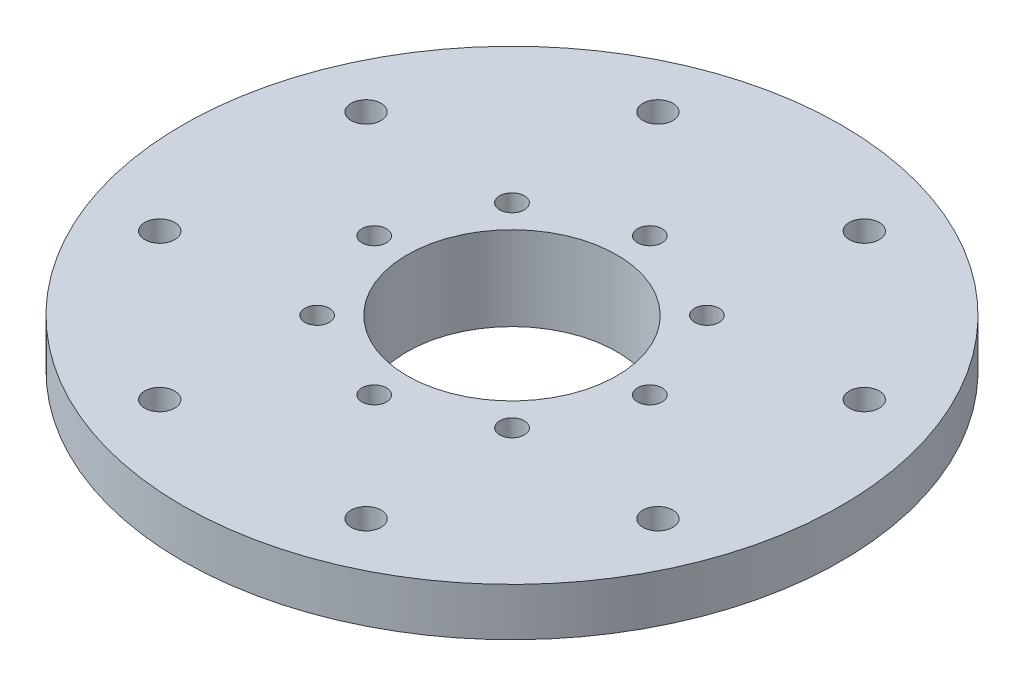
from build123d import *

# Parameters (mm, degrees)
SKETCH1_R                   = 55
BOSS_EXTRUDE1_DEPTH         = 8
SKETCH2_R                   = 27
BOSS_EXTRUDE2_DEPTH         = 6
SKETCH3_R                   = 17.5
CUT_EXTRUDE1_DEPTH          = 80.031639234
M4_CLEARANCE_HOLE1_D        = 4.1
CIRPATTERN1_COUNT           = 8
TAP_DRILL_FOR_M6X1_0_TAP1_D = 5
CIRPATTERN2_COUNT           = 8


with BuildPart() as part:
    # Sketch1 → Boss-Extrude1 (new body)
    with BuildSketch(Plane(origin=(0, 0, 0), x_dir=(1, 0, 0), z_dir=(0, 1, 0))):
        with Locations(Location((0, 0, 0), (0, 0, 270))):
            Circle(SKETCH1_R)
    extrude(amount=BOSS_EXTRUDE1_DEPTH)

    # Sketch2 → Boss-Extrude2 (add)
    with BuildSketch(Plane.XZ):
        with Locations(Location((0, 0, 0), (0, 0, 270))):
            Circle(SKETCH2_R)
    extrude(amount=BOSS_EXTRUDE2_DEPTH)

    # Sketch3 → Cut-Extrude1 (cut, through all)
    with BuildSketch(Plane(origin=(0, 8, 0), x_dir=(1, 0, 0), z_dir=(0, 1, 0))):
        with Locations(Location((0, 0, 0), (0, 0, 270))):
            Circle(SKETCH3_R)
    extrude(amount=-CUT_EXTRUDE1_DEPTH, mode=Mode.SUBTRACT)

    # M4 Clearance Hole1 (through all)
    with Locations(Plane(origin=(0, 8, 0), x_dir=(1, 0, 0), z_dir=(0, 1, 0))):
        with Locations((0, 23)):
            m4_clearance_hole1 = Hole(M4_CLEARANCE_HOLE1_D / 2)

    # CirPattern1: M4 Clearance Hole1 ×8 about axis
    cirpattern1_axis = Axis((0, 0, 0), (0, 1, 0))
    for i in range(1, CIRPATTERN1_COUNT):
        add(m4_clearance_hole1.rotate(cirpattern1_axis, i * 360 / CIRPATTERN1_COUNT), mode=Mode.SUBTRACT)

    # Tap Drill for M6x1.0 Tap1 (through all)
    with Locations(Plane(origin=(0, 8, 0), x_dir=(1, 0, 0), z_dir=(0, 1, 0))):
        with Locations((17.220754456, 41.574578963)):
            tap_drill_for_m6x1_0_tap1 = Hole(TAP_DRILL_FOR_M6X1_0_TAP1_D / 2)

    # CirPattern2: Tap Drill for M6x1.0 Tap1 ×8 about axis
    cirpattern2_axis = Axis((0, 0, 0), (0, 1, 0))
    for i in range(1, CIRPATTERN2_COUNT):
        add(tap_drill_for_m6x1_0_tap1.rotate(cirpattern2_axis, i * 360 / CIRPATTERN2_COUNT), mode=Mode.SUBTRACT)


solid = part.part
